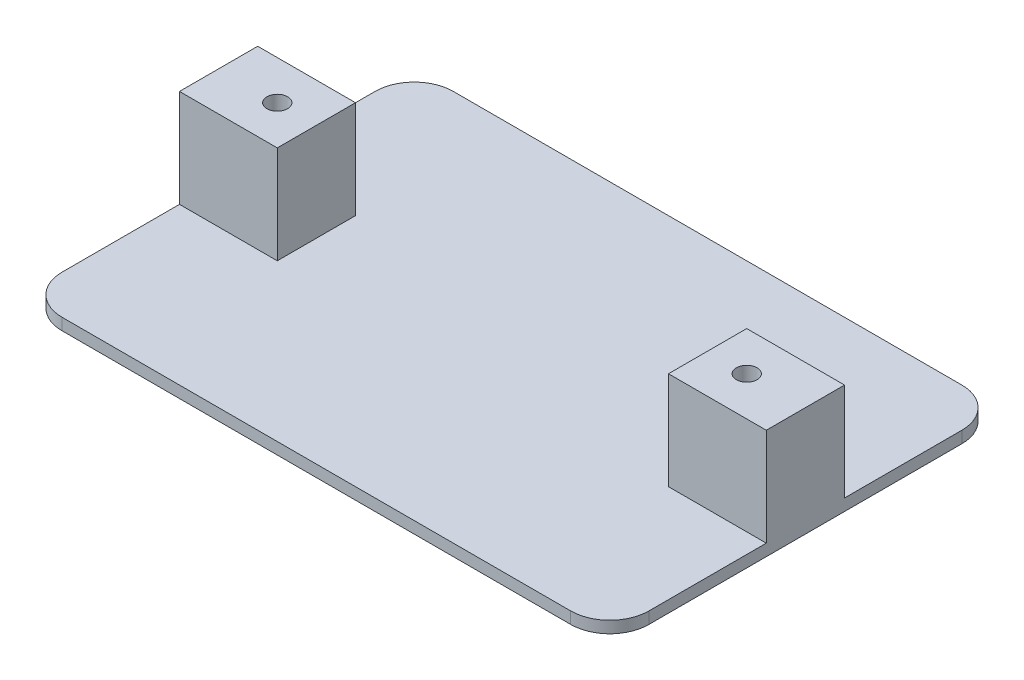
from build123d import *

# Parameters (mm, degrees)
SKETCH1_W           = 150
SKETCH1_H           = 100
SKETCH1_R           = 2.6
BOSS_EXTRUDE1_DEPTH = 3
SKETCH2_R           = 2.65
BOSS_EXTRUDE2_DEPTH = 25
FILLET1_R           = 10


with BuildPart() as part:
    # Sketch1 → Boss-Extrude1 (new body)
    with BuildSketch(Plane(origin=(0, 0, 0), x_dir=(1, 0, 0), z_dir=(0, 1, 0))):
        Rectangle(SKETCH1_W, SKETCH1_H)
        with Locations(Location((-60, 0, 0), (0, 0, 270))):
            Circle(SKETCH1_R, mode=Mode.SUBTRACT)
        with Locations(Location((60, 0, 0), (0, 0, 270))):
            Circle(SKETCH1_R, mode=Mode.SUBTRACT)
    extrude(amount=BOSS_EXTRUDE1_DEPTH)

    # Sketch2 → Boss-Extrude2 (add)
    # profile 1 of 2: a face of its own
    with BuildSketch(Plane(origin=(0, 3, 0), x_dir=(1, 0, 0), z_dir=(0, 1, 0))):
        Polygon((-70, -10), (-50, -10), (-50, 10), (-70, 10), (-75, 10), (-75, -10), align=None)
        with Locations(Location((-60, 0, 0), (0, 0, 270))):
            Circle(SKETCH2_R, mode=Mode.SUBTRACT)
    # profile 2 of 2: a face of its own
    with BuildSketch(Plane(origin=(0, 3, 0), x_dir=(1, 0, 0), z_dir=(0, 1, 0))):
        Polygon((49.997605223, -10.002394777), (70.002394777, -10.002394777), (75, -10.002394777), (75, 10.002394777), (70.002394777, 10.002394777), (49.997605223, 10.002394777), align=None)
        with Locations(Location((60, 0, 0), (0, 0, 270))):
            Circle(SKETCH2_R, mode=Mode.SUBTRACT)
    extrude(amount=BOSS_EXTRUDE2_DEPTH)

    # Fillet1
    fillet1_edges = [part.edges().sort_by_distance(p)[0] for p in [
        (75, 1.5, 50),
        (-75, 1.5, 50),
        (-75, 1.5, -50),
        (75, 1.5, -50),
    ]]
    fillet(fillet1_edges, radius=FILLET1_R)


solid = part.part
